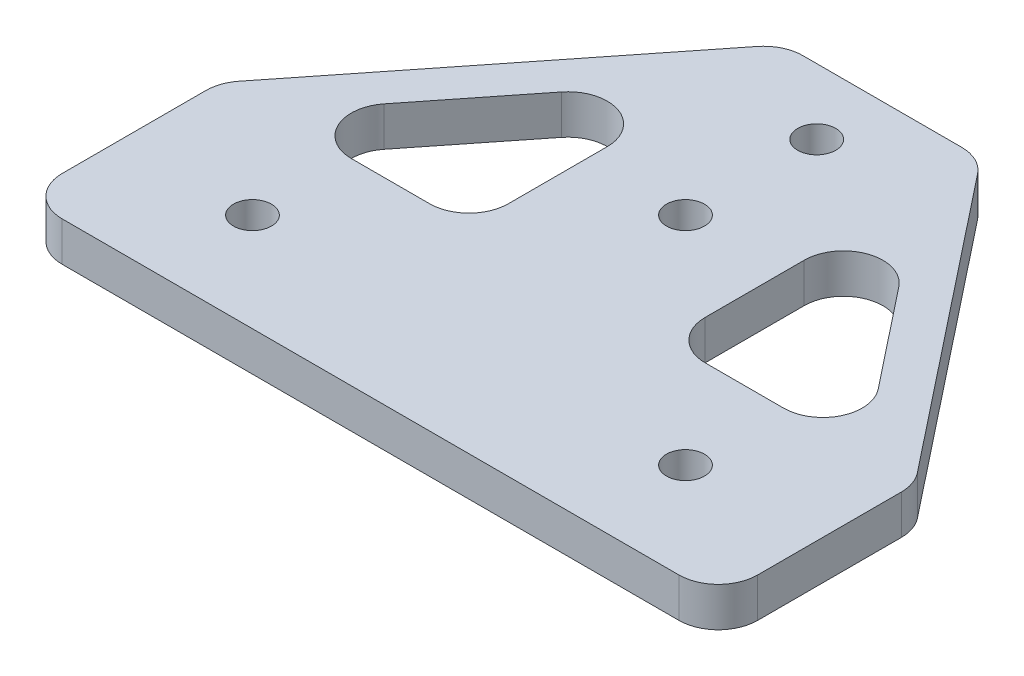
from build123d import *

# Parameters (mm, degrees)
SKETCH_1_R      = 1.45
EXTRUDE_1_DEPTH = 3
FILLET_2_R      = 3


with BuildPart() as part:
    # 草图1 → 凸台-拉伸1 (new body)
    with BuildSketch(Plane(origin=(0, 0, 0), x_dir=(1, 0, 0), z_dir=(0, 1, 0))):
        Polygon((7.5, 31.5), (26.5, 7.5), (26.5, -7.5), (-26.5, -7.5), (-26.5, 7.5), (-7.5, 31.5), align=None)
        with Locations(Location((0, 26.5, 0), (0, 0, 270))):
            Circle(SKETCH_1_R, mode=Mode.SUBTRACT)
        with Locations(Location((0, 16.5, 0), (0, 0, 270))):
            Circle(SKETCH_1_R, mode=Mode.SUBTRACT)
        with Locations(Location((16.5, 0, 0), (0, 0, 270))):
            Circle(SKETCH_1_R, mode=Mode.SUBTRACT)
        with Locations(Location((-16.5, 0, 0), (0, 0, 270))):
            Circle(SKETCH_1_R, mode=Mode.SUBTRACT)
        Polygon((-7.5, 7.5), (-7.5, 26.666770148), (-22.673693034, 7.5), align=None, mode=Mode.SUBTRACT)
        Polygon((22.673693034, 7.5), (7.5, 7.5), (7.5, 26.666770148), align=None, mode=Mode.SUBTRACT)
    extrude(amount=EXTRUDE_1_DEPTH)

    # 圆角2
    fillet_2_edges = [part.edges().sort_by_distance(p)[0] for p in [
        (22.673693034, 1.5, -7.5),
        (7.5, 1.5, -26.666770148),
        (7.5, 1.5, -7.5),
        (26.5, 1.5, -7.5),
        (26.5, 1.5, 7.5),
        (-26.5, 1.5, 7.5),
        (-26.5, 1.5, -7.5),
        (-7.5, 1.5, -31.5),
        (7.5, 1.5, -31.5),
        (-7.5, 1.5, -26.666770148),
        (-22.673693034, 1.5, -7.5),
        (-7.5, 1.5, -7.5),
    ]]
    fillet(fillet_2_edges, radius=FILLET_2_R)


solid = part.part
